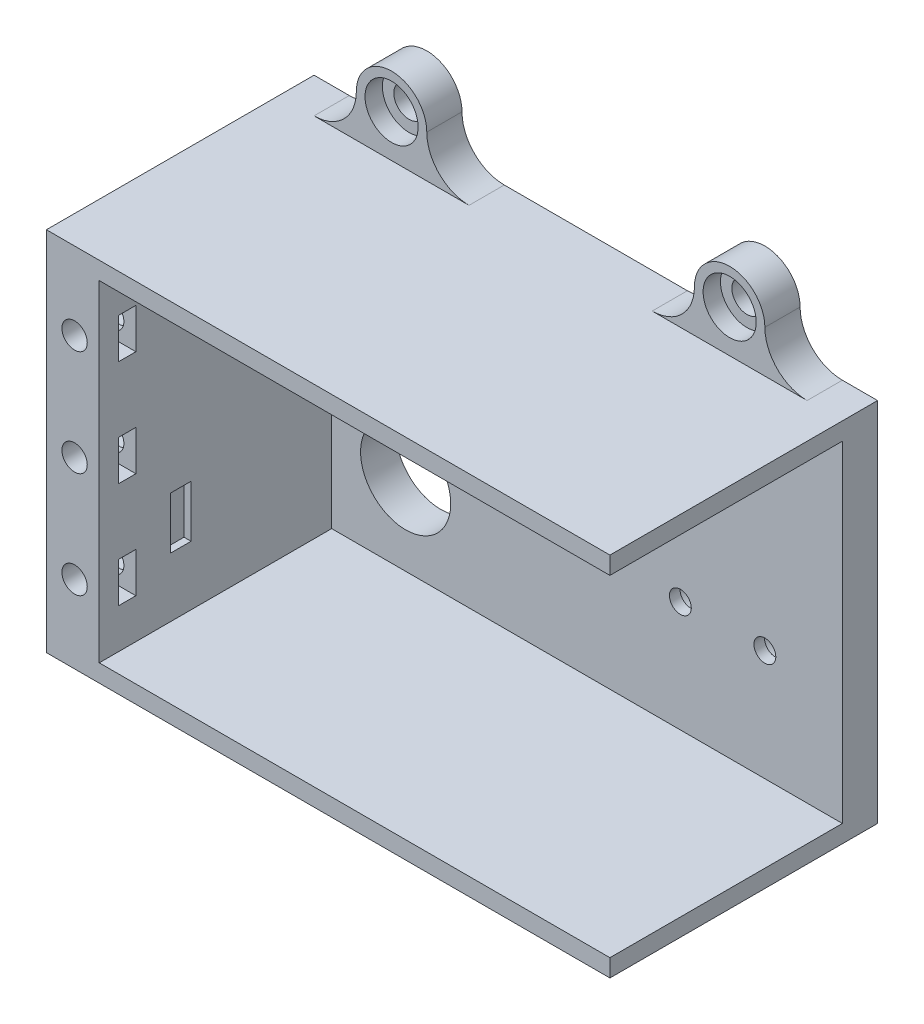
from build123d import *

# Parameters (mm, degrees)
ESQUISSE3_W                                        = 80
ESQUISSE3_H                                        = 52
BOSS_EXTRU_1_DEPTH                                 = 5
ESQUISSE4_R                                        = 6.4
ENL_V_MAT_EXTRU_1_DEPTH                            = 10
BOSS_EXTRU_2_DEPTH                                 = 33
CHAMBRAGE_POUR_VIS_T_TE_RONDE_BOMB_E_M_D           = 3.1
CHAMBRAGE_POUR_VIS_T_TE_RONDE_BOMB_E_M_CBORE_D     = 6
CHAMBRAGE_POUR_VIS_T_TE_RONDE_BOMB_E_M_CBORE_DEPTH = 3.5
R_P_TITION_LIN_AIRE1_COUNT                         = 2
R_P_TITION_LIN_AIRE1_PITCH                         = 12
R_P_TITION_LIN_AIRE1_COUNT_DIR2                    = 2
R_P_TITION_LIN_AIRE1_PITCH_DIR2                    = 24
ENL_V_MAT_EXTRU_2_REACH                            = 94.304
ESQUISSE11_W                                       = 2.5
ESQUISSE11_H                                       = 5.7
R_P_TITION_LIN_AIRE2_COUNT                         = 3
R_P_TITION_LIN_AIRE2_PITCH                         = 15
R_P_TITION_LIN_AIRE3_COUNT                         = 3
R_P_TITION_LIN_AIRE3_PITCH                         = 15
BOSS_EXTRU_3_DEPTH                                 = 5
CHAMBRAGE_POUR_VIS_T_TE_RONDE_BOMB_E_D             = 4.3053
CHAMBRAGE_POUR_VIS_T_TE_RONDE_BOMB_E_CBORE_D       = 7.54126
CHAMBRAGE_POUR_VIS_T_TE_RONDE_BOMB_E_CBORE_DEPTH   = 2.4638
ESQUISSE19_W                                       = 2.951567909
ESQUISSE19_H                                       = 7.383496099
ENL_V_MAT_EXTRU_3_DEPTH                            = 1


with BuildPart() as part:
    # Esquisse3 → Boss.-Extru.1 (new body)
    with BuildSketch(Plane.XY):
        Rectangle(ESQUISSE3_W, ESQUISSE3_H)
    extrude(amount=BOSS_EXTRU_1_DEPTH)

    # Esquisse4 → Enlèv. mat.-Extru.1 (cut)
    with BuildSketch(Plane.XY.offset(5)):
        with Locations((-22, -12)):
            Circle(ESQUISSE4_R)
    extrude(amount=-ENL_V_MAT_EXTRU_1_DEPTH, mode=Mode.SUBTRACT)

    # Esquisse5 → Boss.-Extru.2 (add)
    with BuildSketch(Plane.XY.offset(5)):
        Polygon((-40, -26), (40, -26), (40, -23.5), (-32.5, -23.5), (-32.5, 23.5), (40, 23.5), (40, 26), (-40, 26), align=None)
    extrude(amount=BOSS_EXTRU_2_DEPTH)

    # Chambrage pour vis à tête ronde bombée M2.51 (through all)
    with Locations(Plane(origin=(0, 0, 0), x_dir=(-1, 0, 0), z_dir=(0, 0, -1))):
        with Locations((-17, 16.25)):
            chambrage_pour_vis_t_te_ronde_bomb_e_m = CounterBoreHole(CHAMBRAGE_POUR_VIS_T_TE_RONDE_BOMB_E_M_D / 2, CHAMBRAGE_POUR_VIS_T_TE_RONDE_BOMB_E_M_CBORE_D / 2, CHAMBRAGE_POUR_VIS_T_TE_RONDE_BOMB_E_M_CBORE_DEPTH)

    # Répétition linéaire1: Chambrage pour vis à tête ronde bombée #61 M 2 × 2
    with Locations(*[(i * R_P_TITION_LIN_AIRE1_PITCH, -j * R_P_TITION_LIN_AIRE1_PITCH_DIR2, 0) for i in range(R_P_TITION_LIN_AIRE1_COUNT) for j in range(R_P_TITION_LIN_AIRE1_COUNT_DIR2) if (i, j) != (0, 0)]):
        add(chambrage_pour_vis_t_te_ronde_bomb_e_m, mode=Mode.SUBTRACT)

    # Esquisse11 → Enlèv. mat.-Extru.2 (cut, up to next)
    with BuildSketch(Plane.ZY.offset(40), mode=Mode.PRIVATE) as enl_v_mat_extru_2_sk1:
        with Locations((34.05, 15)):
            Rectangle(ESQUISSE11_W, ESQUISSE11_H)
    enl_v_mat_extru_2_tool1 = extrude(enl_v_mat_extru_2_sk1.sketch, amount=-ENL_V_MAT_EXTRU_2_REACH, mode=Mode.PRIVATE) & part.part
    enl_v_mat_extru_2 = enl_v_mat_extru_2_tool1.solids().sort_by_distance((-40, 15, 34.05))[0]
    add(enl_v_mat_extru_2, mode=Mode.SUBTRACT)

    # Répétition linéaire2: Enlèv. mat.-Extru.2 ×3
    with Locations(*[(0, -i * R_P_TITION_LIN_AIRE2_PITCH, 0) for i in range(1, R_P_TITION_LIN_AIRE2_COUNT)]):
        add(enl_v_mat_extru_2, mode=Mode.SUBTRACT)

    # Esquisse15 → Dégagement M31 (revolve, cut)
    with BuildSketch(Plane(origin=(-36, 15, 38), x_dir=(0, -1, 0), z_dir=(1, 0, 0))):
        Polygon((0, 0), (0, 7.431549114), (1.8, 6.35), (1.8, 0), align=None)
    d_gagement_m31 = revolve(axis=Axis((-36, 15, 44.35), (0, 0, -1)), mode=Mode.SUBTRACT)

    # Répétition linéaire3: Dégagement M31 ×3
    with Locations(*[(0, -i * R_P_TITION_LIN_AIRE3_PITCH, 0) for i in range(1, R_P_TITION_LIN_AIRE3_COUNT)]):
        add(d_gagement_m31, mode=Mode.SUBTRACT)

    # Esquisse16 → Boss.-Extru.3 (add)
    with BuildSketch(Plane(origin=(0, 0, 0), x_dir=(-1, 0, 0), z_dir=(0, 0, -1))):
        with BuildLine():
            Line((-35, 26), (-13, 26))
            ThreePointArc((-13, 26), (-17.242640687, 27.757359313), (-19, 32))
            ThreePointArc((-19, 32), (-24, 37), (-29, 32))
            ThreePointArc((-29, 32), (-30.757359313, 27.757359313), (-35, 26))
        make_face()
        with BuildLine():
            Line((13, 26), (35, 26))
            ThreePointArc((35, 26), (30.757359313, 27.757359313), (29, 32))
            ThreePointArc((29, 32), (24, 37), (19, 32))
            ThreePointArc((19, 32), (17.242640687, 27.757359313), (13, 26))
        make_face()
        with BuildLine():
            Line((-35, -26), (-13, -26))
            ThreePointArc((-13, -26), (-17.242640687, -27.757359313), (-19, -32))
            ThreePointArc((-19, -32), (-24, -37), (-29, -32))
            ThreePointArc((-29, -32), (-30.757359313, -27.757359313), (-35, -26))
        make_face()
        with BuildLine():
            Line((13, -26), (35, -26))
            ThreePointArc((35, -26), (30.757359313, -27.757359313), (29, -32))
            ThreePointArc((29, -32), (24, -37), (19, -32))
            ThreePointArc((19, -32), (17.242640687, -27.757359313), (13, -26))
        make_face()
    extrude(amount=-BOSS_EXTRU_3_DEPTH)

    # Chambrage pour vis à tête ronde bombée #61 (through all)
    with Locations(Plane.XY.offset(5)):
        with Locations((-24, 32), (24, 32), (24, -32), (-24, -32)):
            CounterBoreHole(CHAMBRAGE_POUR_VIS_T_TE_RONDE_BOMB_E_D / 2, CHAMBRAGE_POUR_VIS_T_TE_RONDE_BOMB_E_CBORE_D / 2, CHAMBRAGE_POUR_VIS_T_TE_RONDE_BOMB_E_CBORE_DEPTH)

    # Esquisse19 → Enlèv. mat.-Extru.3 (cut)
    with BuildSketch(Plane(origin=(-32.5, 0, 0), x_dir=(0, 0, -1), z_dir=(1, 0, 0))):
        with Locations((-26.438573375, -11.379122074)):
            Rectangle(ESQUISSE19_W, ESQUISSE19_H)
    extrude(amount=-ENL_V_MAT_EXTRU_3_DEPTH, mode=Mode.SUBTRACT)


solid = part.part
